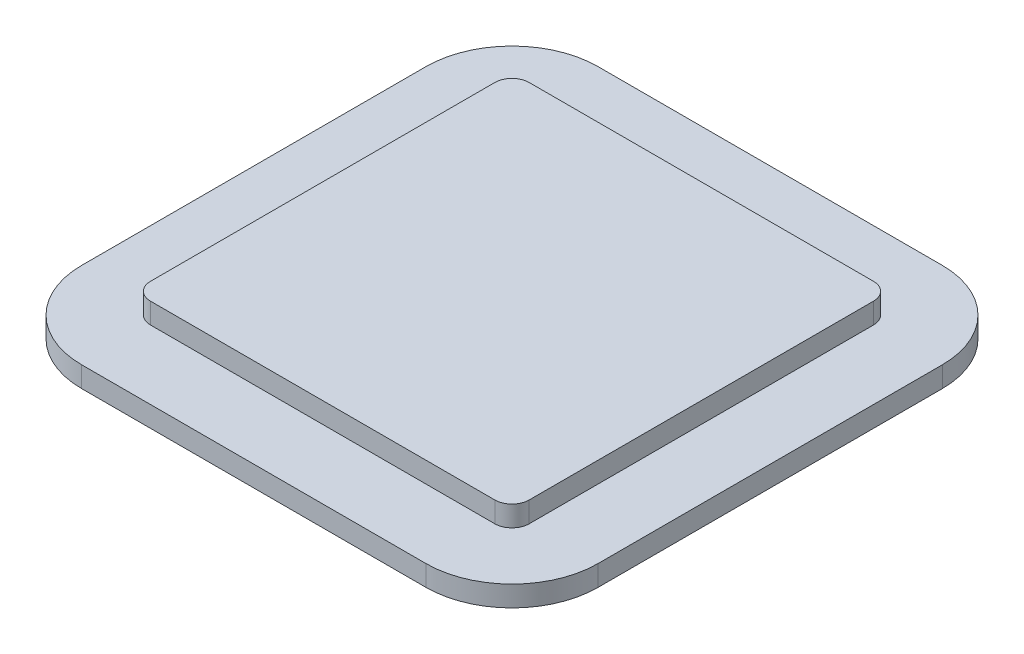
from build123d import *

# Parameters (mm, degrees)
SKETCH_1_W      = 15
SKETCH_1_H      = 15
EXTRUDE_1_DEPTH = 0.6
FILLET_1_R      = 2.5
SKETCH_2_W      = 11
SKETCH_2_H      = 11
EXTRUDE_2_DEPTH = 0.6
FILLET_2_R      = 0.5


with BuildPart() as part:
    # 草图1 → 凸台-拉伸1 (new body)
    with BuildSketch(Plane(origin=(0, 0, 0), x_dir=(1, 0, 0), z_dir=(0, 1, 0))):
        with Locations((53.495024876, 28.718905473)):
            Rectangle(SKETCH_1_W, SKETCH_1_H)
    extrude(amount=EXTRUDE_1_DEPTH)

    # 圆角1
    fillet_1_edges = [part.edges().sort_by_distance(p)[0] for p in [
        (45.995024876, 0.3, -36.218905473),
        (60.995024876, 0.3, -36.218905473),
        (60.995024876, 0.3, -21.218905473),
        (45.995024876, 0.3, -21.218905473),
    ]]
    fillet(fillet_1_edges, radius=FILLET_1_R)

    # 草图2 → 凸台-拉伸2 (add)
    with BuildSketch(Plane(origin=(0, 0.6, 0), x_dir=(1, 0, 0), z_dir=(0, 1, 0))):
        with Locations((53.495024876, 28.718905473)):
            Rectangle(SKETCH_2_W, SKETCH_2_H)
    extrude(amount=EXTRUDE_2_DEPTH)

    # 圆角2
    fillet_2_edges = [part.edges().sort_by_distance(p)[0] for p in [
        (47.995024876, 0.9, -34.218905473),
        (47.995024876, 0.9, -23.218905473),
        (58.995024876, 0.9, -23.218905473),
        (58.995024876, 0.9, -34.218905473),
    ]]
    fillet(fillet_2_edges, radius=FILLET_2_R)


solid = part.part
